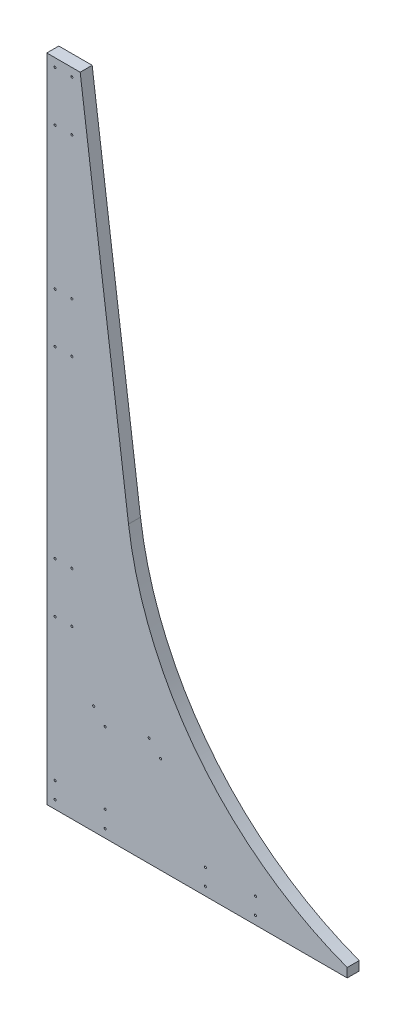
from build123d import *

# Parameters (mm, degrees)
BOSS_EXTRUDE1_DEPTH = 18.25625
SKETCH2_R           = 1.5875
CUT_EXTRUDE1_DEPTH  = 1092.171116308
SKETCH3_R           = 1.5875
CUT_EXTRUDE2_DEPTH  = 1092.171116308


with BuildPart() as part:
    # Sketch1 → Boss-Extrude1 (new body)
    with BuildSketch(Plane.XY):
        with BuildLine():
            Line((0, 990.6), (0, 0))
            Line((0, 0), (457.201, 0))
            Line((457.201, 0), (457.201, 13.862038208))
            ThreePointArc((457.201, 13.862038208), (232.767577124, 176.628269142), (124.367415652, 431.8))
            Line((124.367415652, 431.8), (50.8, 990.6))
            Line((50.8, 990.6), (0, 990.6))
        make_face()
    extrude(amount=BOSS_EXTRUDE1_DEPTH)

    # Sketch2 → Cut-Extrude1 (cut, through all)
    with BuildSketch(Plane.XY.offset(18.25625)):
        with Locations((12.7, 977.9)):
            Circle(SKETCH2_R)
        with Locations((38.1, 977.9)):
            Circle(SKETCH2_R)
        with Locations((12.7, 901.7)):
            Circle(SKETCH2_R)
        with Locations((38.1, 901.7)):
            Circle(SKETCH2_R)
        with Locations((12.7, 609.6)):
            Circle(SKETCH2_R)
        with Locations((38.1, 609.6)):
            Circle(SKETCH2_R)
        with Locations((12.7, 685.8)):
            Circle(SKETCH2_R)
        with Locations((38.1, 685.8)):
            Circle(SKETCH2_R)
        with Locations((12.7, 254)):
            Circle(SKETCH2_R)
        with Locations((38.1, 254)):
            Circle(SKETCH2_R)
        with Locations((12.7, 330.2)):
            Circle(SKETCH2_R)
        with Locations((38.1, 330.2)):
            Circle(SKETCH2_R)
        with Locations((12.7, 38.1)):
            Circle(SKETCH2_R)
        with Locations((12.7, 12.7)):
            Circle(SKETCH2_R)
        with Locations((88.9, 38.1)):
            Circle(SKETCH2_R)
        with Locations((88.9, 12.7)):
            Circle(SKETCH2_R)
        with Locations((241.3, 38.1)):
            Circle(SKETCH2_R)
        with Locations((317.5, 38.1)):
            Circle(SKETCH2_R)
        with Locations((241.3, 12.7)):
            Circle(SKETCH2_R)
        with Locations((317.5, 12.7)):
            Circle(SKETCH2_R)
    extrude(amount=-CUT_EXTRUDE1_DEPTH, mode=Mode.SUBTRACT)

    # Sketch3 → Cut-Extrude2 (cut, through all)
    with BuildSketch(Plane.XY.offset(18.25625)):
        with Locations((88.9, 147.112433493)):
            Circle(SKETCH3_R)
        with Locations((71.4248, 165.527433493)):
            Circle(SKETCH3_R)
        with Locations((155.8036, 165.527433493)):
            Circle(SKETCH3_R)
        with Locations((173.2788, 147.112433493)):
            Circle(SKETCH3_R)
    extrude(amount=-CUT_EXTRUDE2_DEPTH, mode=Mode.SUBTRACT)


solid = part.part
